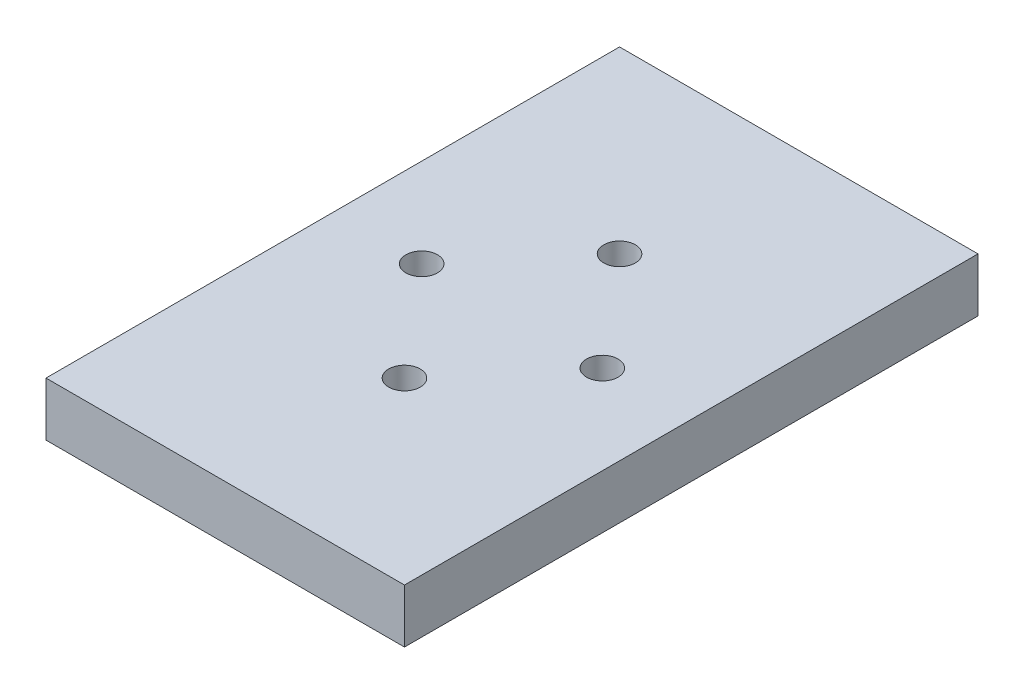
from build123d import *

# Parameters (mm, degrees)
SKETCH1_W           = 31.75
SKETCH1_H           = 50.8
SKETCH1_R           = 1.397
BOSS_EXTRUDE1_DEPTH = 4.7625


with BuildPart() as part:
    # Sketch1 → Boss-Extrude1 (new body)
    with BuildSketch(Plane(origin=(0, 0, 0), x_dir=(1, 0, 0), z_dir=(0, 1, 0))):
        with Locations((15.875, 25.4)):
            Rectangle(SKETCH1_W, SKETCH1_H)
        with Locations(Location((7.874, 25.4, 0), (0, 0, 90))):
            Circle(SKETCH1_R, mode=Mode.SUBTRACT)
        with Locations(Location((15.875, 34.925, 0), (0, 0, 90))):
            Circle(SKETCH1_R, mode=Mode.SUBTRACT)
        with Locations(Location((23.876, 25.4, 0), (0, 0, 90))):
            Circle(SKETCH1_R, mode=Mode.SUBTRACT)
        with Locations(Location((15.875, 15.875, 0), (0, 0, 90))):
            Circle(SKETCH1_R, mode=Mode.SUBTRACT)
    extrude(amount=BOSS_EXTRUDE1_DEPTH)


solid = part.part
